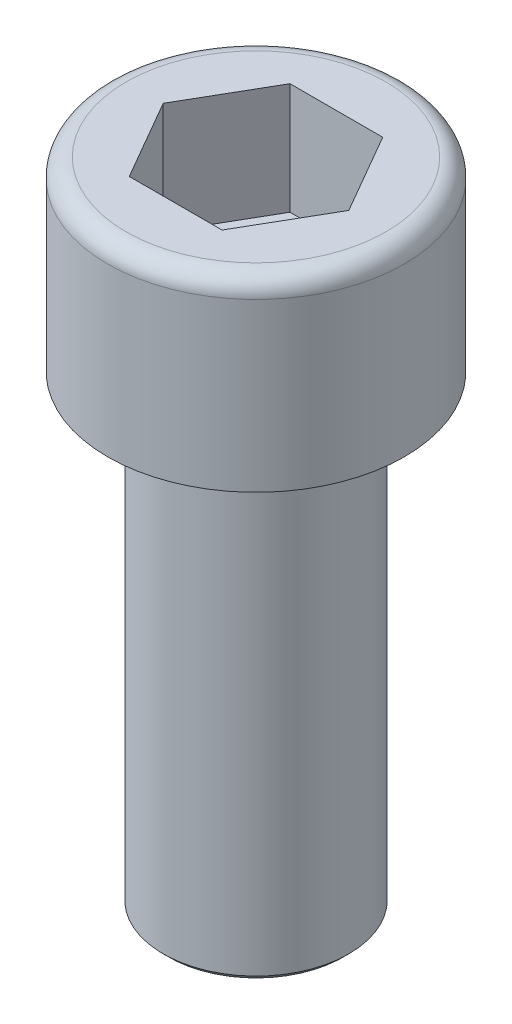
from build123d import *

# Parameters (mm, degrees)
FILLET_1_R          = 1
CUT_EXTRUDE_START   = 10
CUT_EXTRUDE_1_DEPTH = 6
CHAMFER_1_SIZE      = 0.3


with BuildPart() as part:
    # 草图1 → 旋转1 (revolve)
    with BuildSketch(Plane.XY, mode=Mode.PRIVATE) as revolve_1_sk:
        Polygon((0, 10), (8, 10), (8, 0), (5, 0), (5, -25), (0, -25), align=None)
    revolve(revolve_1_sk.sketch.rotate(Axis((0, 10, 0), (0, -1, 0)), 180), axis=Axis((0, 10, 0), (0, -1, 0)))

    # 圆角1
    fillet_1_edges = [part.edges().sort_by_distance(p)[0] for p in [
        (8, 10, 0),
    ]]
    fillet(fillet_1_edges, radius=FILLET_1_R)

    # 草图2 → 切除-拉伸1 (cut)
    with BuildSketch(Plane(origin=(0, 0, 0), x_dir=(1, 0, 0), z_dir=(0, 1, 0)).offset(CUT_EXTRUDE_START)):
        Polygon((5, 0), (2.5, 4.330127019), (-2.5, 4.330127019), (-5, 0), (-2.5, -4.330127019), (2.5, -4.330127019), align=None)
    extrude(amount=-CUT_EXTRUDE_1_DEPTH, mode=Mode.SUBTRACT)

    # 倒角1
    chamfer_1_edges = [part.edges().sort_by_distance(p)[0] for p in [
        (5, -25, 0),
    ]]
    chamfer(chamfer_1_edges, length=CHAMFER_1_SIZE)


solid = part.part
